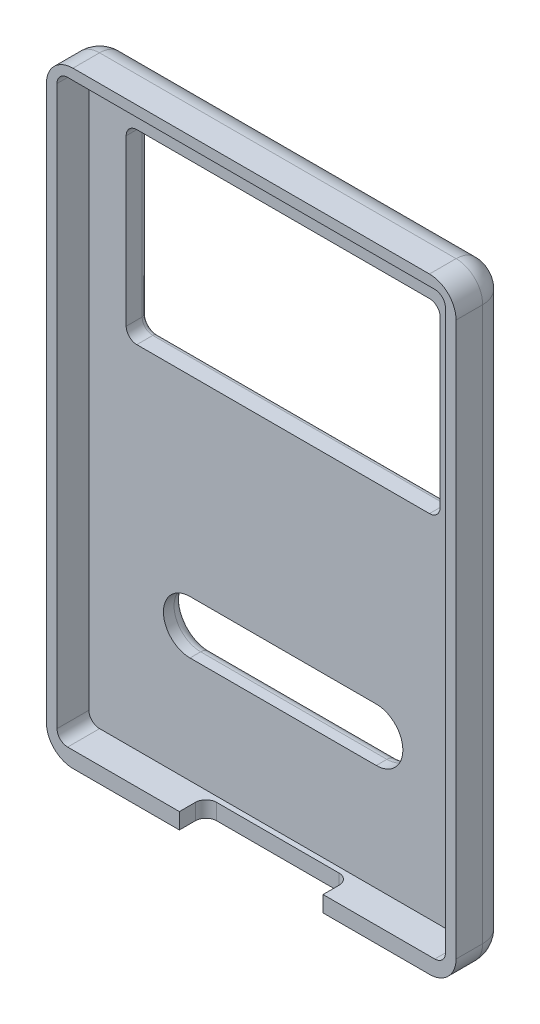
from build123d import *

# Parameters (mm, degrees)
SKETCH1_W           = 77
SKETCH1_H           = 114
BOSS_EXTRUDE1_DEPTH = 10
SKETCH2_W           = 73
SKETCH2_H           = 109
CUT_EXTRUDE1_DEPTH  = 6
SKETCH3_W           = 59
SKETCH3_H           = 35
CUT_EXTRUDE2_DEPTH  = 6
FILLET1_R           = 5
FILLET2_R           = 5
FILLET3_R           = 2
FILLET4_R           = 2
SKETCH7_W           = 27
SKETCH7_H           = 5
CUT_EXTRUDE8_DEPTH  = 6
FILLET5_R           = 2
CUT_EXTRUDE9_DEPTH  = 10
FILLET6_R           = 2
FILLET7_R           = 1


with BuildPart() as part:
    # Sketch1 → Boss-Extrude1 (new body)
    with BuildSketch(Plane.XY):
        with Locations((38.5, 51.816921292)):
            Rectangle(SKETCH1_W, SKETCH1_H)
    extrude(amount=BOSS_EXTRUDE1_DEPTH)

    # Sketch2 → Cut-Extrude1 (cut)
    with BuildSketch(Plane.XY.offset(10)):
        with Locations((38.5, 52.316921292)):
            Rectangle(SKETCH2_W, SKETCH2_H)
    extrude(amount=-CUT_EXTRUDE1_DEPTH, mode=Mode.SUBTRACT)

    # Sketch3 → Cut-Extrude2 (cut)
    with BuildSketch(Plane.XY.offset(4)):
        with Locations((38.5, 81.316921292)):
            Rectangle(SKETCH3_W, SKETCH3_H)
    extrude(amount=-CUT_EXTRUDE2_DEPTH, mode=Mode.SUBTRACT)

    # Fillet1
    fillet1_edges = [part.edges().sort_by_distance(p)[0] for p in [
        (0, 108.816921292, 5),
        (77, 108.816921292, 5),
        (77, -5.183078708, 5),
        (0, -5.183078708, 5),
    ]]
    fillet(fillet1_edges, radius=FILLET1_R)

    # Fillet2
    fillet2_edges = [part.edges().sort_by_distance(p)[0] for p in [
        (38.5, -5.183078708, 0),
        (0, 51.816921292, 0),
        (38.5, 108.816921292, 0),
        (77, 51.816921292, 0),
        (75.535533906, 107.352455198, 0),
        (1.464466094, 107.352455198, 0),
        (75.535533906, -3.718612614, 0),
        (1.464466094, -3.718612614, 0),
    ]]
    fillet(fillet2_edges, radius=FILLET2_R)

    # Fillet3
    fillet3_edges = [part.edges().sort_by_distance(p)[0] for p in [
        (9, 63.816921292, 2),
        (9, 98.816921292, 2),
        (68, 98.816921292, 2),
        (68, 63.816921292, 2),
    ]]
    fillet(fillet3_edges, radius=FILLET3_R)

    # Fillet4
    fillet4_edges = [part.edges().sort_by_distance(p)[0] for p in [
        (2, -2.183078708, 7),
        (2, 106.816921292, 7),
        (75, 106.816921292, 7),
        (75, -2.183078708, 7),
    ]]
    fillet(fillet4_edges, radius=FILLET4_R)

    # Sketch7 → Cut-Extrude8 (cut)
    with BuildSketch(Plane.XZ.offset(5.183078708)):
        with Locations((38.5, 7.5)):
            Rectangle(SKETCH7_W, SKETCH7_H)
    extrude(amount=-CUT_EXTRUDE8_DEPTH, mode=Mode.SUBTRACT)

    # Fillet5
    fillet5_edges = [part.edges().sort_by_distance(p)[0] for p in [
        (52, -3.683078708, 5),
        (25, -3.683078708, 5),
    ]]
    fillet(fillet5_edges, radius=FILLET5_R)

    # Sketch8 → Cut-Extrude9 (cut)
    with BuildSketch(Plane(origin=(0, 0, 0), x_dir=(-1, 0, 0), z_dir=(0, 0, -1))):
        with BuildLine():
            Line((-56, 27.816921292), (-21, 27.816921292))
            ThreePointArc((-21, 27.816921292), (-16, 22.816921292), (-21, 17.816921292))
            Line((-21, 17.816921292), (-56, 17.816921292))
            ThreePointArc((-56, 17.816921292), (-61, 22.816921292), (-56, 27.816921292))
        make_face()
    extrude(amount=-CUT_EXTRUDE9_DEPTH, mode=Mode.SUBTRACT)

    # Fillet6
    fillet6_edges = [part.edges().sort_by_distance(p)[0] for p in [
        (61, 22.816921292, 0),
        (38.5, 17.816921292, 0),
        (16, 22.816921292, 0),
        (38.5, 27.816921292, 0),
    ]]
    fillet(fillet6_edges, radius=FILLET6_R)

    # Fillet7
    fillet7_edges = [part.edges().sort_by_distance(p)[0] for p in [
        (68, 81.316921292, 0),
        (38.5, 63.816921292, 0),
        (9, 81.316921292, 0),
        (38.5, 98.816921292, 0),
        (67.414213562, 64.402707729, 0),
        (9.585786438, 64.402707729, 0),
        (9.585786438, 98.231134854, 0),
        (67.414213562, 98.231134854, 0),
    ]]
    fillet(fillet7_edges, radius=FILLET7_R)


solid = part.part
